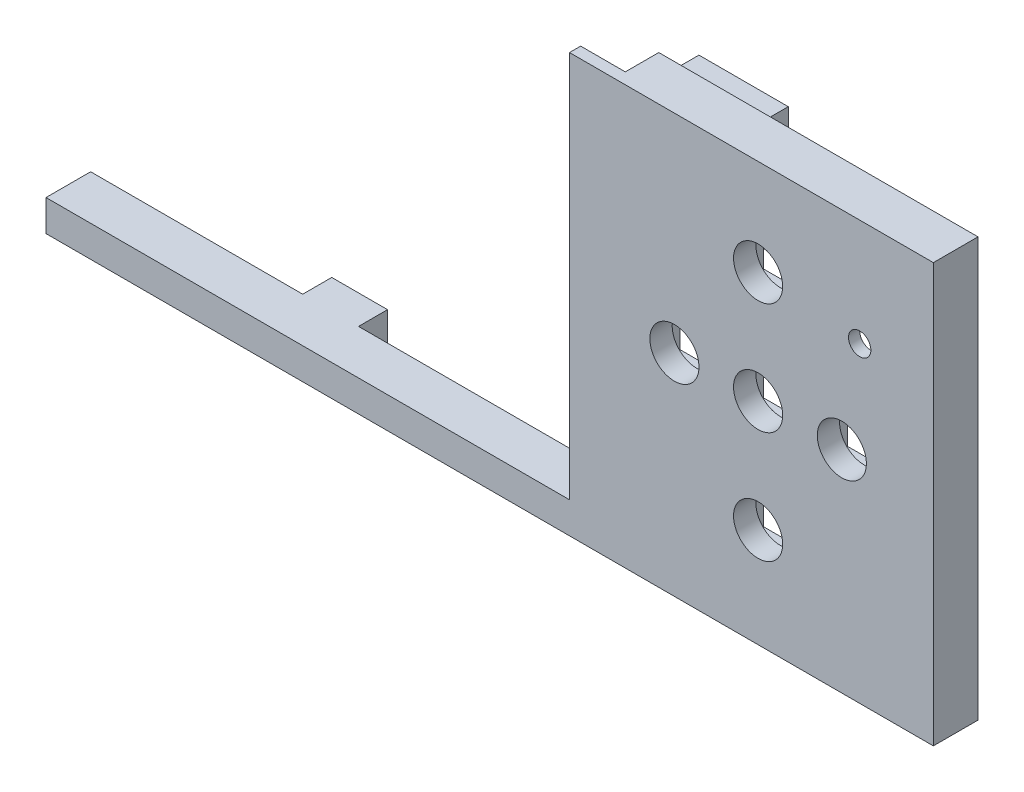
from build123d import *

# Parameters (mm, degrees)
SZKIC1_R                    = 2.2
SZKIC1_R_2                  = 1
DODANIE_WYCI_GNI_CIE1_DEPTH = 4
SZKIC2_R                    = 5.75
SZKIC2_W                    = 4
SZKIC2_H                    = 34.7
WYTNIJ_WYCI_GNI_CIE1_DEPTH  = 3
SZKIC3_W                    = 5
SZKIC3_H                    = 2.8
SZKIC3_W_2                  = 8
SZKIC3_H_2                  = 10
SZKIC3_H_3                  = 7
DODANIE_WYCI_GNI_CIE2_DEPTH = 2.6
SZKIC4_R                    = 5.75
SZKIC4_W                    = 7
SZKIC4_H                    = 7
SZKIC4_R_2                  = 2.2
WYTNIJ_WYCI_GNI_CIE3_DEPTH  = 2


with BuildPart() as part:
    # Szkic1 → Dodanie-wyciągnięcie1 (new body)
    with BuildSketch(Plane.XY):
        Polygon((-39.75, -15.95), (-39.75, -18.75), (39.75, -18.75), (39.75, 18.75), (7.15, 18.75), (7.15, -15.95), align=None)
        with Locations((24.05, -9.85)):
            Circle(SZKIC1_R, mode=Mode.SUBTRACT)
        with Locations((16.55, 0.15)):
            Circle(SZKIC1_R, mode=Mode.SUBTRACT)
        with Locations((24.05, 0.15)):
            Circle(SZKIC1_R, mode=Mode.SUBTRACT)
        with Locations((31.55, 0.15)):
            Circle(SZKIC1_R, mode=Mode.SUBTRACT)
        with Locations((33.15, 9.15)):
            Circle(SZKIC1_R_2, mode=Mode.SUBTRACT)
        with Locations((24.05, 10.15)):
            Circle(SZKIC1_R, mode=Mode.SUBTRACT)
    extrude(amount=DODANIE_WYCI_GNI_CIE1_DEPTH)

    # Szkic2 → Wytnij-wyciągnięcie1 (cut)
    with BuildSketch(Plane(origin=(0, 0, 0), x_dir=(-1, 0, 0), z_dir=(0, 0, -1))):
        with Locations((-33.15, 9.15)):
            Circle(SZKIC2_R)
        with Locations((-9.15, 1.4)):
            Rectangle(SZKIC2_W, SZKIC2_H)
    extrude(amount=-WYTNIJ_WYCI_GNI_CIE1_DEPTH, mode=Mode.SUBTRACT)

    # Szkic3 → Dodanie-wyciągnięcie2 (add)
    with BuildSketch(Plane(origin=(0, 0, 0), x_dir=(-1, 0, 0), z_dir=(0, 0, -1))):
        with Locations((18.25, -17.35)):
            Rectangle(SZKIC3_W, SZKIC3_H)
        with Locations((-16.15, 12.75)):
            Rectangle(SZKIC3_W_2, SZKIC3_H_2)
        with Locations((-31.55, -11.35)):
            Rectangle(SZKIC3_W, SZKIC3_H_3)
    extrude(amount=DODANIE_WYCI_GNI_CIE2_DEPTH)

    # Szkic4 → Wytnij-wyciągnięcie3 (cut)
    # profile 1 of 9: a face of its own
    with BuildSketch(Plane(origin=(0, 0, 0), x_dir=(-1, 0, 0), z_dir=(0, 0, -1))):
        with BuildLine():
            Line((-27.55, 10.454798835), (-27.55, 13.65))
            Line((-27.55, 13.65), (-29.570544734, 13.65))
            ThreePointArc((-29.570544734, 13.65), (-28.290172085, 12.223202342), (-27.55, 10.454798835))
        make_face()
    # profile 2 of 9: a face of its own
    with BuildSketch(Plane(origin=(0, 0, 0), x_dir=(-1, 0, 0), z_dir=(0, 0, -1))):
        with BuildLine():
            Line((-27.55, 6.65), (-27.55, 7.845201165))
            ThreePointArc((-27.55, 7.845201165), (-27.727927326, 7.235939416), (-27.971921206, 6.65))
            Line((-27.971921206, 6.65), (-27.55, 6.65))
        make_face()
    # profile 3 of 9: a face of its own
    with BuildSketch(Plane(origin=(0, 0, 0), x_dir=(-1, 0, 0), z_dir=(0, 0, -1))):
        with Locations((-33.15, 9.15)):
            Circle(SZKIC4_R)
    # profile 4 of 9: a face of its own
    with BuildSketch(Plane(origin=(0, 0, 0), x_dir=(-1, 0, 0), z_dir=(0, 0, -1))):
        with Locations((-24.05, 10.15)):
            Rectangle(SZKIC4_W, SZKIC4_H)
        with Locations((-24.05, 10.15)):
            Circle(SZKIC4_R_2, mode=Mode.SUBTRACT)
    # profile 5 of 9: a face of its own
    with BuildSketch(Plane(origin=(0, 0, 0), x_dir=(-1, 0, 0), z_dir=(0, 0, -1))):
        with Locations((-24.05, 0.15)):
            Rectangle(SZKIC4_W, SZKIC4_H)
        with Locations((-24.05, 0.15)):
            Circle(SZKIC4_R_2, mode=Mode.SUBTRACT)
    # profile 6 of 9: a face of its own
    with BuildSketch(Plane(origin=(0, 0, 0), x_dir=(-1, 0, 0), z_dir=(0, 0, -1))):
        with Locations((-33.15, 9.15)):
            Circle(SZKIC4_R)
    # profile 7 of 9: a face of its own
    with BuildSketch(Plane(origin=(0, 0, 0), x_dir=(-1, 0, 0), z_dir=(0, 0, -1))):
        with Locations((-31.55, 0.15)):
            Rectangle(SZKIC4_W, SZKIC4_H)
        with Locations((-31.55, 0.15)):
            Circle(SZKIC4_R_2, mode=Mode.SUBTRACT)
    # profile 8 of 9: a face of its own
    with BuildSketch(Plane(origin=(0, 0, 0), x_dir=(-1, 0, 0), z_dir=(0, 0, -1))):
        with Locations((-16.55, 0.15)):
            Rectangle(SZKIC4_W, SZKIC4_H)
        with Locations((-16.55, 0.15)):
            Circle(SZKIC4_R_2, mode=Mode.SUBTRACT)
    # profile 9 of 9: a face of its own
    with BuildSketch(Plane(origin=(0, 0, 0), x_dir=(-1, 0, 0), z_dir=(0, 0, -1))):
        with Locations((-24.05, -9.85)):
            Rectangle(SZKIC4_W, SZKIC4_H)
        with Locations((-24.05, -9.85)):
            Circle(SZKIC4_R_2, mode=Mode.SUBTRACT)
    extrude(amount=-WYTNIJ_WYCI_GNI_CIE3_DEPTH, mode=Mode.SUBTRACT)


solid = part.part
